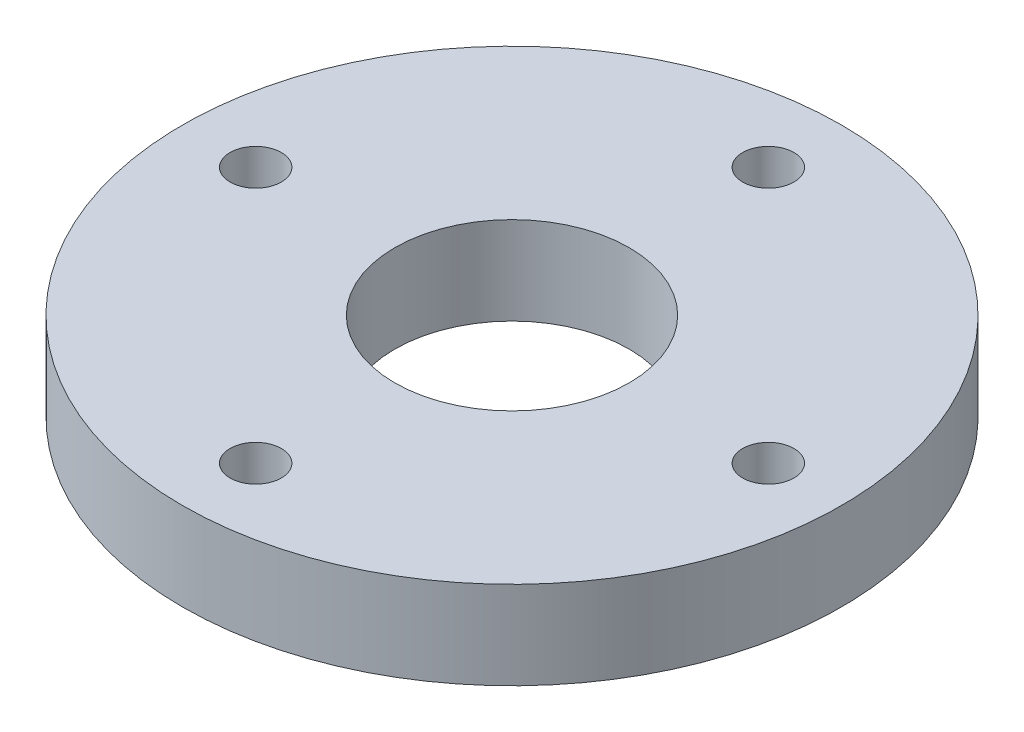
from build123d import *

# Parameters (mm, degrees)
SKETCH1_R           = 22.5
SKETCH1_R_2         = 8
BOSS_EXTRUDE1_DEPTH = 6
SKETCH2_R           = 1.75
CUT_EXTRUDE1_DEPTH  = 6
CIRPATTERN1_COUNT   = 4
SKETCH3_R           = 0.75
CUT_EXTRUDE2_DEPTH  = 5
CIRPATTERN2_COUNT   = 3


with BuildPart() as part:
    # Sketch1 → Boss-Extrude1 (new body)
    with BuildSketch(Plane(origin=(0, 0, 0), x_dir=(1, 0, 0), z_dir=(0, 1, 0))):
        Circle(SKETCH1_R)
        Circle(SKETCH1_R_2, mode=Mode.SUBTRACT)
    extrude(amount=BOSS_EXTRUDE1_DEPTH)

    # Sketch2 → Cut-Extrude1 (cut)
    with BuildSketch(Plane(origin=(0, 6, 0), x_dir=(1, 0, 0), z_dir=(0, 1, 0))):
        with Locations((0, 17.5)):
            Circle(SKETCH2_R)
    cut_extrude1 = extrude(amount=-CUT_EXTRUDE1_DEPTH, mode=Mode.SUBTRACT)

    # CirPattern1: Cut-Extrude1 ×4 about axis
    cirpattern1_axis = Axis((0, -0.3, 0), (0, 1, 0))
    for i in range(1, CIRPATTERN1_COUNT):
        add(cut_extrude1.rotate(cirpattern1_axis, i * 360 / CIRPATTERN1_COUNT), mode=Mode.SUBTRACT)

    # Sketch3 → Cut-Extrude2 (cut)
    with BuildSketch(Plane(origin=(0, 0, 0), x_dir=(-1, 0, 0), z_dir=(0, -1, 0))):
        with Locations((-10.253048327, -10.253048327)):
            Circle(SKETCH3_R)
    cut_extrude2 = extrude(amount=-CUT_EXTRUDE2_DEPTH, mode=Mode.SUBTRACT)

    # CirPattern2: Cut-Extrude2 ×3 about axis
    cirpattern2_axis = Axis((0, -0.3, 0), (0, 1, 0))
    for i in range(1, CIRPATTERN2_COUNT):
        add(cut_extrude2.rotate(cirpattern2_axis, i * 360 / CIRPATTERN2_COUNT), mode=Mode.SUBTRACT)


solid = part.part
